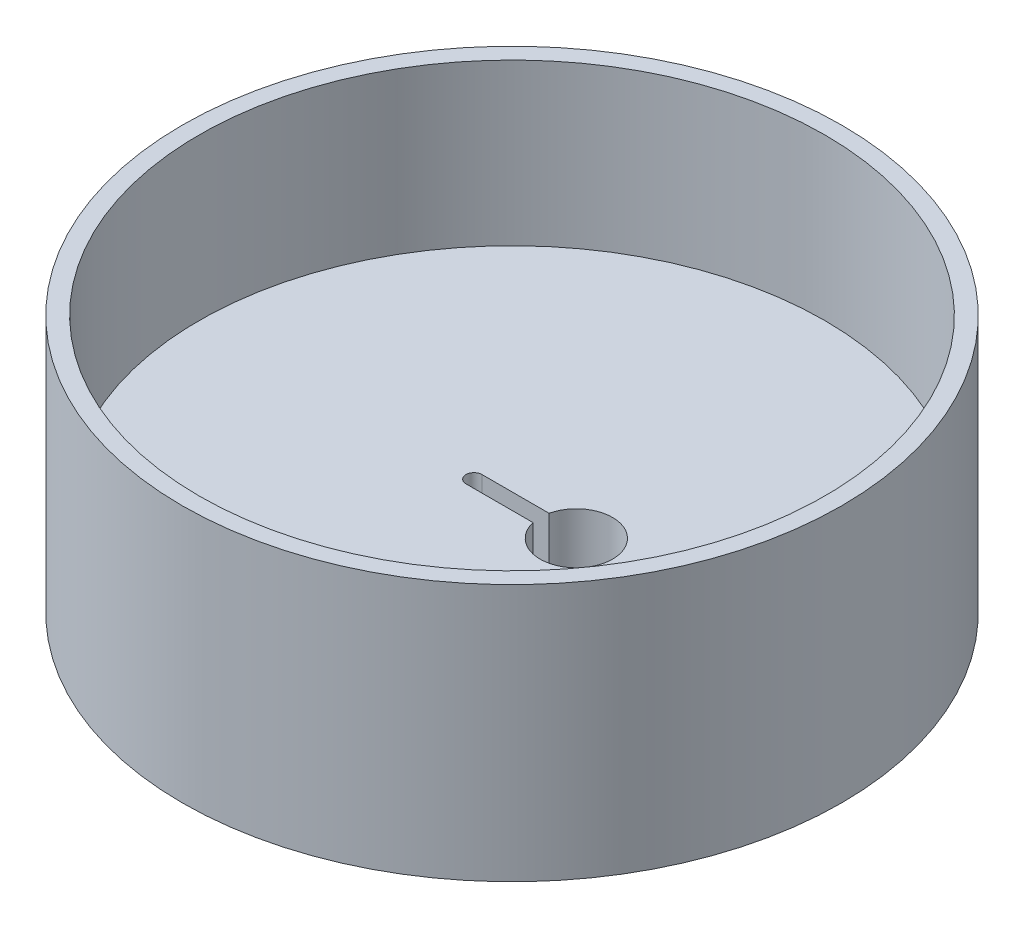
from build123d import *

# Parameters (mm, degrees)
SKETCH1_R                = 19.45
BOSS_EXTRUDE1_DEPTH      = 6
BOSS_EXTRUDE2_DEPTH      = 10
BOSS_EXTRUDE2_DEPTH_BACK = 6
SKETCH2_R                = 20.5
SKETCH2_R_2              = 19.45


with BuildPart() as part:
    # Sketch1 → Boss-Extrude1 (new body)
    with BuildSketch(Plane(origin=(0, 0, 0), x_dir=(1, 0, 0), z_dir=(0, 1, 0))):
        with Locations(Location((0, 0, 0), (0, 0, 270))):
            Circle(SKETCH1_R)
        with BuildLine():
            Line((1.806258903, -0.5), (-2.363228991, -0.5))
            ThreePointArc((-2.363228991, -0.5), (-2.863228991, 0), (-2.363228991, 0.5))
            Line((-2.363228991, 0.5), (1.806258903, 0.5))
            ThreePointArc((1.806258903, 0.5), (6.25, 0), (1.806258903, -0.5))
        make_face(mode=Mode.SUBTRACT)
    extrude(amount=BOSS_EXTRUDE1_DEPTH)

    # Sketch2 → Boss-Extrude2 (add, two sides: drawn at the far end of the back side and taken through both)
    with BuildSketch(Plane(origin=(0, 6, 0), x_dir=(1, 0, 0), z_dir=(0, 1, 0)).offset(-BOSS_EXTRUDE2_DEPTH_BACK)):
        with Locations(Location((0, 0, 0), (0, 0, 270))):
            Circle(SKETCH2_R)
        with Locations(Location((0, 0, 0), (0, 0, 270))):
            Circle(SKETCH2_R_2, mode=Mode.SUBTRACT)
    extrude(amount=BOSS_EXTRUDE2_DEPTH + BOSS_EXTRUDE2_DEPTH_BACK)


solid = part.part
